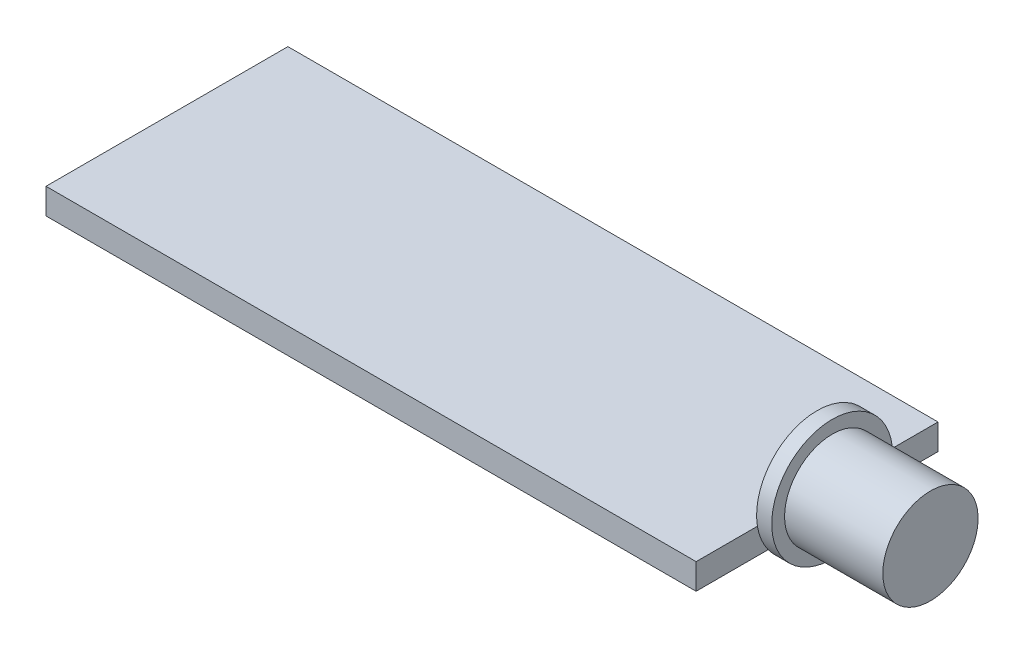
from build123d import *

# Parameters (mm, degrees)
SKETCH1_W           = 43
SKETCH1_H           = 16
BOSS_EXTRUDE1_DEPTH = 1.7
SKETCH2_R           = 4
BOSS_EXTRUDE2_DEPTH = 1
SKETCH3_R           = 3.15
BOSS_EXTRUDE3_DEPTH = 6.5


with BuildPart() as part:
    # Sketch1 → Boss-Extrude1 (new body)
    with BuildSketch(Plane(origin=(0, 0, 0), x_dir=(1, 0, 0), z_dir=(0, 1, 0))):
        with Locations((21.5, 8)):
            Rectangle(SKETCH1_W, SKETCH1_H)
    extrude(amount=BOSS_EXTRUDE1_DEPTH)

    # Sketch2 → Boss-Extrude2 (add)
    with BuildSketch(Plane(origin=(43, 0, 0), x_dir=(0, 0, -1), z_dir=(1, 0, 0))):
        with Locations(Location((8, 2.35, 0), (0, 0, 189.352035058))):
            Circle(SKETCH2_R)
    extrude(amount=BOSS_EXTRUDE2_DEPTH)

    # Sketch3 → Boss-Extrude3 (add)
    with BuildSketch(Plane(origin=(44, 0, 0), x_dir=(0, 0, -1), z_dir=(1, 0, 0))):
        with Locations(Location((8, 2.35, 0), (0, 0, 180))):
            Circle(SKETCH3_R)
    extrude(amount=BOSS_EXTRUDE3_DEPTH)


solid = part.part
